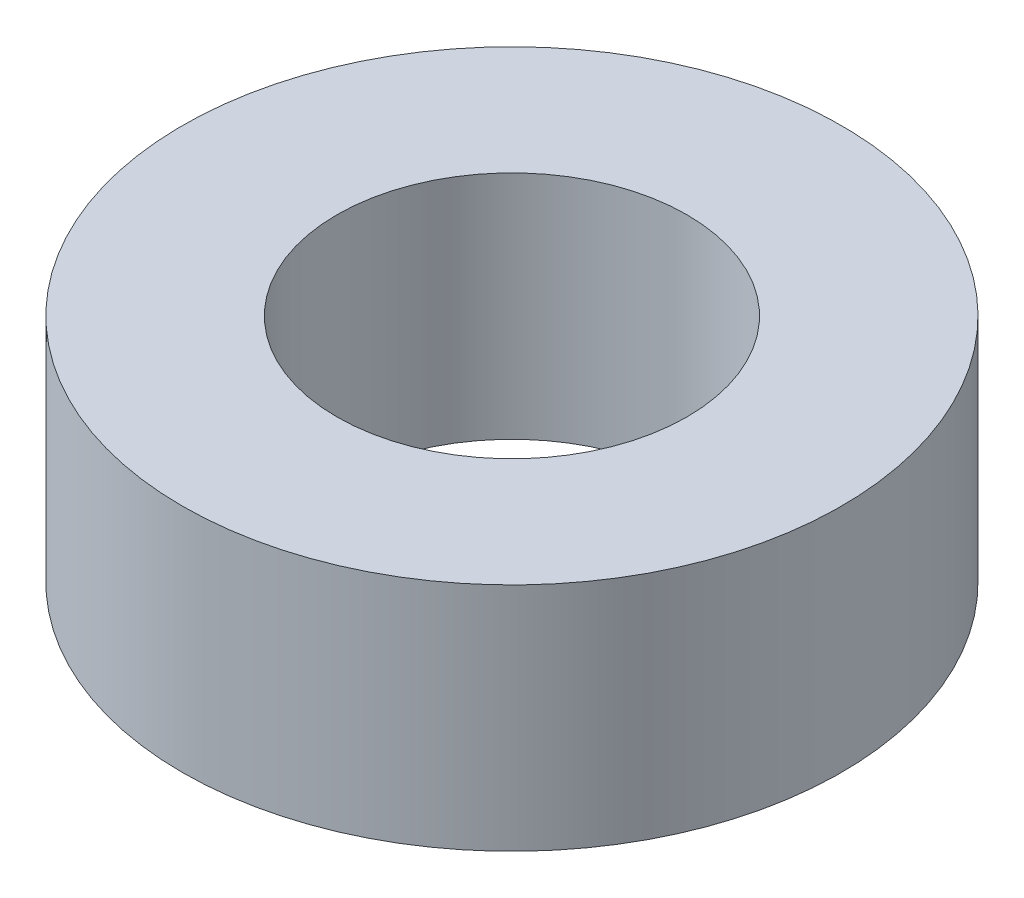
from build123d import *

# Parameters (mm, degrees)
CROQUIS1_R              = 4
CROQUIS1_R_2            = 2.125
SALIENTE_EXTRUIR1_DEPTH = 2.8


with BuildPart() as part:
    # Croquis1 → Saliente-Extruir1 (new body)
    with BuildSketch(Plane(origin=(0, 0, 0), x_dir=(1, 0, 0), z_dir=(0, 1, 0))):
        with Locations(Location((0, 0, 0), (0, 0, 270))):
            Circle(CROQUIS1_R)
        with Locations(Location((0, 0, 0), (0, 0, 270))):
            Circle(CROQUIS1_R_2, mode=Mode.SUBTRACT)
    extrude(amount=SALIENTE_EXTRUIR1_DEPTH)


solid = part.part
